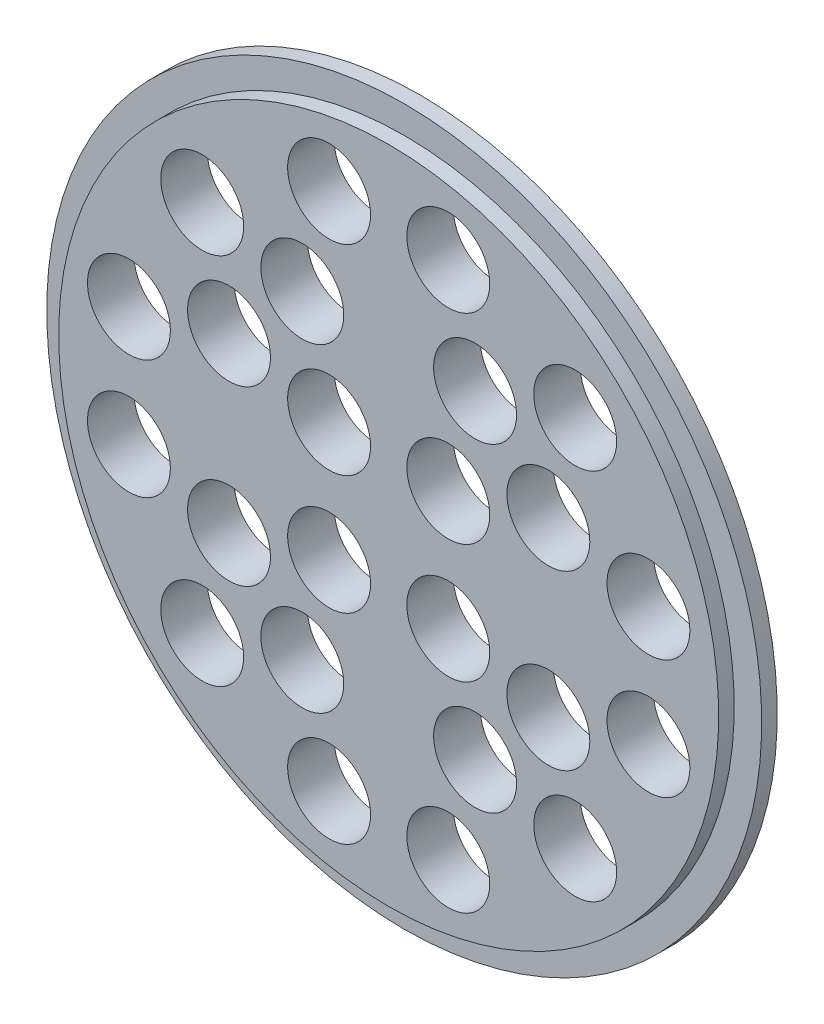
from build123d import *

# Parameters (mm, degrees)
SKETCH1_R               = 34.5
SKETCH1_R_2             = 4
BOSS_EXTRUDE1_DEPTH     = 4.5
SKETCH2_W               = 1.5
SKETCH2_H               = 2.65
CUT_EXTRUDE1_DEPTH      = 49.997448913
CUT_EXTRUDE1_DEPTH_BACK = 49.997448913
SKETCH4_W               = 1.55
SKETCH4_H               = 1.5
SKETCH5_W               = 1.5
SKETCH5_H               = 1.55
CUT_EXTRUDE2_DEPTH      = 49.997448913


with BuildPart() as part:
    # Sketch1 → Boss-Extrude1 (new body)
    with BuildSketch(Plane.XY):
        Circle(SKETCH1_R)
        with Locations((5.75, 5.75)):
            Circle(SKETCH1_R_2, mode=Mode.SUBTRACT)
        with Locations((8.338190451, 15.409258263)):
            Circle(SKETCH1_R_2, mode=Mode.SUBTRACT)
        with Locations((17.997448714, 17.997448714)):
            Circle(SKETCH1_R_2, mode=Mode.SUBTRACT)
        with Locations((15.409258263, 8.338190451)):
            Circle(SKETCH1_R_2, mode=Mode.SUBTRACT)
        with Locations((25.068516526, 5.75)):
            Circle(SKETCH1_R_2, mode=Mode.SUBTRACT)
        with Locations((5.75, 25.068516526)):
            Circle(SKETCH1_R_2, mode=Mode.SUBTRACT)
        with Locations((25.068556101, -5.749960425)):
            Circle(SKETCH1_R_2, mode=Mode.SUBTRACT)
        with Locations((15.409297838, -8.338150876)):
            Circle(SKETCH1_R_2, mode=Mode.SUBTRACT)
        with Locations((17.997488289, -17.997409139)):
            Circle(SKETCH1_R_2, mode=Mode.SUBTRACT)
        with Locations((8.338230026, -15.409218688)):
            Circle(SKETCH1_R_2, mode=Mode.SUBTRACT)
        with Locations((5.750039575, -25.068476951)):
            Circle(SKETCH1_R_2, mode=Mode.SUBTRACT)
        with Locations((5.750039575, -5.749960425)):
            Circle(SKETCH1_R_2, mode=Mode.SUBTRACT)
        with Locations((-5.74992085, -25.068516526)):
            Circle(SKETCH1_R_2, mode=Mode.SUBTRACT)
        with Locations((-8.338111301, -15.409258263)):
            Circle(SKETCH1_R_2, mode=Mode.SUBTRACT)
        with Locations((-17.997369564, -17.997448714)):
            Circle(SKETCH1_R_2, mode=Mode.SUBTRACT)
        with Locations((-15.409179113, -8.338190451)):
            Circle(SKETCH1_R_2, mode=Mode.SUBTRACT)
        with Locations((-25.068437376, -5.75)):
            Circle(SKETCH1_R_2, mode=Mode.SUBTRACT)
        with Locations((-5.74992085, -5.75)):
            Circle(SKETCH1_R_2, mode=Mode.SUBTRACT)
        with Locations((-25.068476951, 5.749960425)):
            Circle(SKETCH1_R_2, mode=Mode.SUBTRACT)
        with Locations((-15.409218688, 8.338150876)):
            Circle(SKETCH1_R_2, mode=Mode.SUBTRACT)
        with Locations((-17.997409139, 17.997409139)):
            Circle(SKETCH1_R_2, mode=Mode.SUBTRACT)
        with Locations((-8.338150876, 15.409218688)):
            Circle(SKETCH1_R_2, mode=Mode.SUBTRACT)
        with Locations((-5.749960425, 25.068476951)):
            Circle(SKETCH1_R_2, mode=Mode.SUBTRACT)
        with Locations((-5.749960425, 5.749960425)):
            Circle(SKETCH1_R_2, mode=Mode.SUBTRACT)
    extrude(amount=BOSS_EXTRUDE1_DEPTH)

    # Sketch2 → Cut-Revolve1 (revolve, cut)
    with BuildSketch(Plane(origin=(0, 0, 0), x_dir=(0, 0, -1), z_dir=(1, 0, 0))):
        with Locations((-0.75, 33.175)):
            Rectangle(SKETCH2_W, SKETCH2_H)
        with Locations((-3.75, 33.175)):
            Rectangle(SKETCH2_W, SKETCH2_H)
    revolve(axis=Axis((0, 0, 0), (0, 0, 1)), mode=Mode.SUBTRACT)

    # Sketch4 → Cut-Extrude1 (cut, two sides: drawn at the far end of the back side and taken through both)
    with BuildSketch(Plane(origin=(0, 0, 0), x_dir=(1, 0, 0), z_dir=(0, 1, 0)).offset(-CUT_EXTRUDE1_DEPTH_BACK)):
        with Locations((0, -0.75)):
            Rectangle(SKETCH4_W, SKETCH4_H)
    extrude(amount=CUT_EXTRUDE1_DEPTH + CUT_EXTRUDE1_DEPTH_BACK, mode=Mode.SUBTRACT)

    # Sketch5 → Cut-Extrude2 (cut, through all)
    with BuildSketch(Plane(origin=(0, 0, 0), x_dir=(0, 0, -1), z_dir=(1, 0, 0))):
        with Locations((-0.75, 0)):
            Rectangle(SKETCH5_W, SKETCH5_H)
    extrude(amount=-CUT_EXTRUDE2_DEPTH, mode=Mode.SUBTRACT)


solid = part.part
